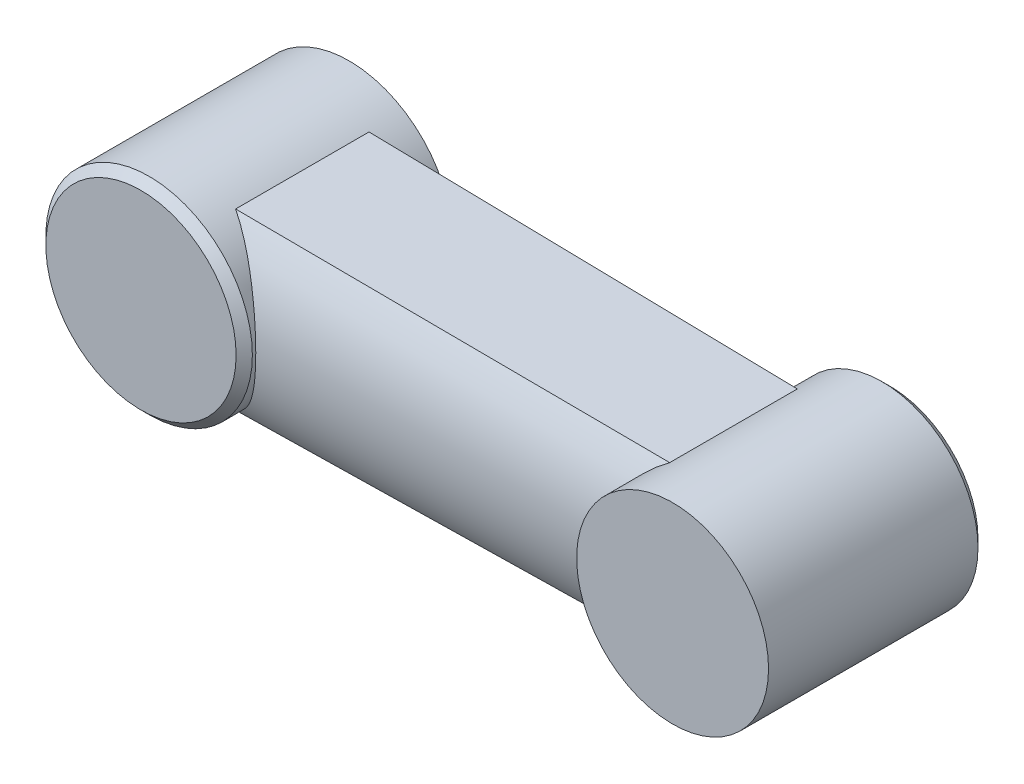
from build123d import *

# Parameters (mm, degrees)
BOSS_EXTRUDE1_DEPTH      = 64
BOSS_EXTRUDE1_DEPTH_BACK = 64
SKETCH1_R                = 63.5
CHAMFER1_SIZE            = 5
BOSS_EXTRUDE2_DEPTH      = 67.3
BOSS_EXTRUDE2_DEPTH_BACK = 66.5
SKETCH9_R                = 59
CHAMFER2_SIZE            = 5


with BuildPart() as part:
    # Sketch1 → Boss-Extrude1 (new, two sides: drawn at the far end of the back side and taken through both)
    with BuildSketch(Plane.XY.offset(-BOSS_EXTRUDE1_DEPTH_BACK)):
        Circle(SKETCH1_R)
    extrude(amount=BOSS_EXTRUDE1_DEPTH + BOSS_EXTRUDE1_DEPTH_BACK)

    # Chamfer1
    chamfer1_edges = [part.edges().sort_by_distance(p)[0] for p in [
        (-63.5, 0, 64),
    ]]
    chamfer(chamfer1_edges, length=CHAMFER1_SIZE)

    # Sketch6 for Loft1 → Loft1 section 0
    with BuildSketch(Plane.ZY):
        with BuildLine():
            Line((40.120383673, -54), (-42.379616327, -54))
            # circular arc as an exact rational Bezier (weights 1, cos(half-angle), 1)
            Bezier((-42.379616327, -54), (-75.725192624, 0), (-42.379616327, 54), weights=[1, 0.850849875, 1])
            Line((-42.379616327, 54), (40.120383673, 54))
            Bezier((40.120383673, 54), (79.472033784, 0), (40.120383673, -54), weights=[1, 0.80817386, 1])
        make_face()
    # Sketch7 for Loft1 → Loft1 section 1
    with BuildSketch(Plane(origin=(330.2, 0, 59), x_dir=(0, 0, 1), z_dir=(-1, 0, 0))):
        with BuildLine():
            Line((-21.003548385, -49.884), (-99.052818608, -49.884))
            Bezier((-99.052818608, -49.884), (-128.286627078, 0), (-99.052818608, 49.884), weights=[1, 0.862762376, 1])
            Line((-99.052818608, 49.884), (-21.003548385, 49.884))
            Bezier((-21.003548385, 49.884), (13.568719727, 0), (-21.003548385, -49.884), weights=[1, 0.821905309, 1])
        make_face()
    loft()

    # Sketch9 → Boss-Extrude2 (add, two sides: drawn at the far end of the back side and taken through both)
    with BuildSketch(Plane.XY.offset(-BOSS_EXTRUDE2_DEPTH_BACK)):
        with Locations((330.2, 0)):
            Circle(SKETCH9_R)
    extrude(amount=BOSS_EXTRUDE2_DEPTH + BOSS_EXTRUDE2_DEPTH_BACK)

    # Chamfer2
    chamfer2_edges = [part.edges().sort_by_distance(p)[0] for p in [
        (271.2, 0, -66.5),
    ]]
    chamfer(chamfer2_edges, length=CHAMFER2_SIZE)


solid = part.part
